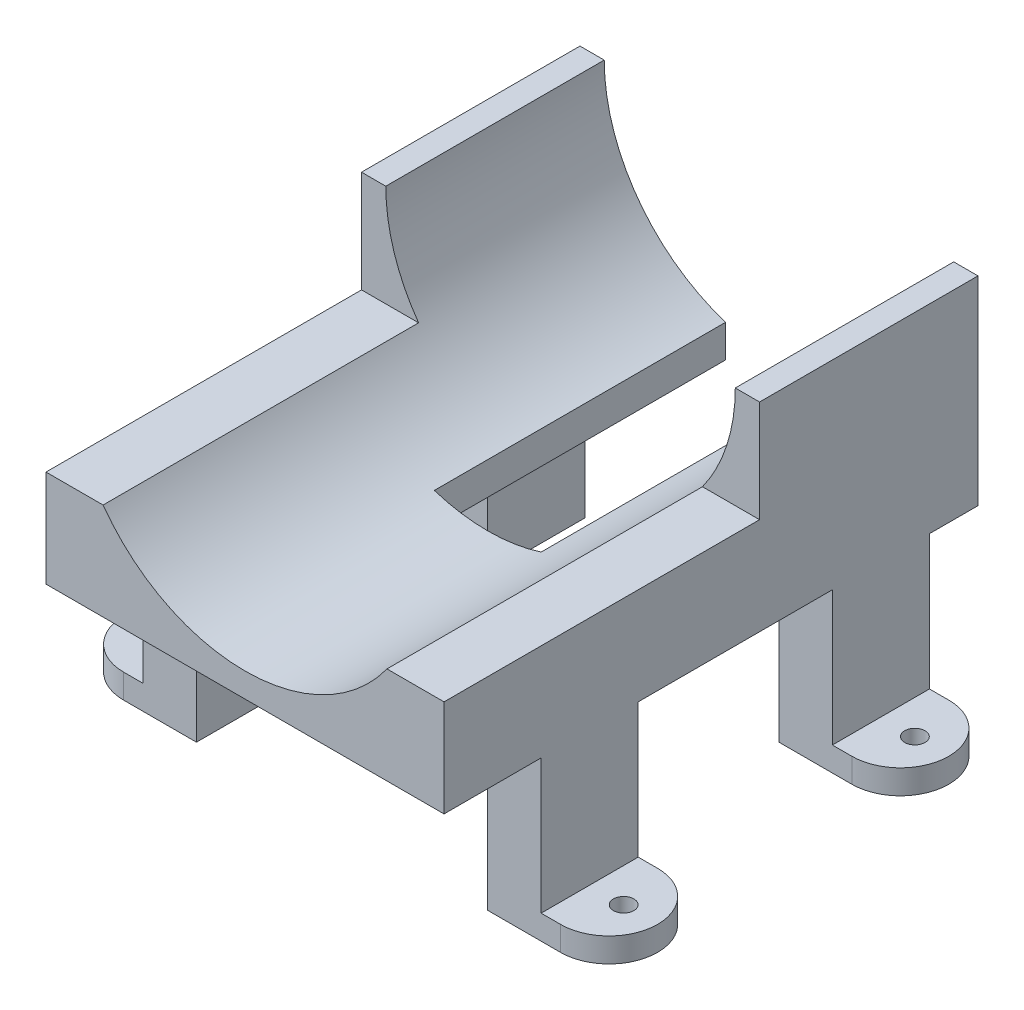
from build123d import *

# Parameters (mm, degrees)
SKETCH_1_R               = 36
EXTRUDE_1_DEPTH          = 90
SKETCH_2_W               = 22
SKETCH_2_H               = 6.721726998
CUT_EXTRUDE_1_DEPTH      = 60
CUT_EXTRUDE_2_DEPTH      = 108.060730429
CUT_EXTRUDE_2_DEPTH_BACK = 108.060730429
EXTRUDE_3_DEPTH          = 20
SKETCH_5_R               = 2.1
CUT_EXTRUDE_3_DEPTH      = 126.87569265
PATTERN_LINEAR_1_COUNT   = 2
PATTERN_LINEAR_1_PITCH   = 60
EXTRUDE_4_DEPTH          = 20


with BuildPart() as part:
    # 草圖1 → 填料-伸長1 (new body)
    with BuildSketch(Plane.XY):
        with BuildLine():
            Line((-41, 0), (-41, -41))
            Line((-41, -41), (41, -41))
            Line((41, -41), (41, 0))
            ThreePointArc((41, 0), (0, 41), (-41, 0))
        make_face()
        with Locations(Location((0, 0, 0), (0, 0, 180))):
            Circle(SKETCH_1_R, mode=Mode.SUBTRACT)
    extrude(amount=EXTRUDE_1_DEPTH)

    # 草圖2 → 除料-伸長1 (cut)
    with BuildSketch(Plane.XY):
        with Locations((0, -37.639136501)):
            Rectangle(SKETCH_2_W, SKETCH_2_H)
    extrude(amount=CUT_EXTRUDE_1_DEPTH, mode=Mode.SUBTRACT)

    # 草圖3 → 除料-伸長2 (cut, two sides: drawn at the far end of the back side and taken through both)
    with BuildSketch(Plane(origin=(0, 0, 0), x_dir=(0, 0, -1), z_dir=(1, 0, 0)).offset(-CUT_EXTRUDE_2_DEPTH_BACK)):
        Polygon((0, 41), (-90, 41), (-90, -21), (-45, -21), (-45, 0), (0, 0), align=None)
    extrude(amount=CUT_EXTRUDE_2_DEPTH + CUT_EXTRUDE_2_DEPTH_BACK, mode=Mode.SUBTRACT)

    # 草圖4 → 填料-伸長3 (add)
    with BuildSketch(Plane.XY.offset(90)):
        with BuildLine():
            Line((-30, -73.7), (-30, -27.946386022))
            ThreePointArc((-30, -27.946386022), (-32.791276328, -24.611637258), (-35.213640705, -21))
            Line((-35.213640705, -21), (-41, -21))
            Line((-41, -21), (-41, -68.7))
            Line((-41, -68.7), (-55, -68.7))
            Line((-55, -68.7), (-55, -73.7))
            Line((-55, -73.7), (-30, -73.7))
        make_face()
        with BuildLine():
            Line((30, -73.7), (30, -27.946386022))
            ThreePointArc((30, -27.946386022), (32.791276328, -24.611637258), (35.213640705, -21))
            Line((35.213640705, -21), (41, -21))
            Line((41, -21), (41, -68.7))
            Line((41, -68.7), (55, -68.7))
            Line((55, -68.7), (55, -73.7))
            Line((55, -73.7), (30, -73.7))
        make_face()
    extrude_3 = extrude(amount=-EXTRUDE_3_DEPTH)

    # 草圖5 → 除料-伸長3 (cut, through all)
    with BuildSketch(Plane(origin=(0, -68.7, 0), x_dir=(1, 0, 0), z_dir=(0, 1, 0))):
        with Locations(Location((-48, -80, 0), (0, 0, 180))):
            Circle(SKETCH_5_R)
        with Locations(Location((48, -80, 0), (0, 0, 180))):
            Circle(SKETCH_5_R)
        with BuildLine():
            Line((45, -70), (45, -66.851466146))
            Line((45, -66.851466146), (57.675759509, -66.851466146))
            Line((57.675759509, -66.851466146), (57.675759509, -92.046945096))
            Line((57.675759509, -92.046945096), (45, -92.046945096))
            Line((45, -92.046945096), (45, -90))
            ThreePointArc((45, -90), (55, -80), (45, -70))
        make_face()
        with BuildLine():
            Line((-57.675759509, -92.046945096), (-45, -92.046945096))
            Line((-45, -92.046945096), (-45, -90))
            ThreePointArc((-45, -90), (-55, -80), (-45, -70))
            Line((-45, -70), (-45, -66.851466146))
            Line((-45, -66.851466146), (-57.675759509, -66.851466146))
            Line((-57.675759509, -66.851466146), (-57.675759509, -92.046945096))
        make_face()
    cut_extrude_3 = extrude(amount=-CUT_EXTRUDE_3_DEPTH, mode=Mode.SUBTRACT)

    # 直線複製排列1: 填料-伸長3, 除料-伸長3 ×2
    with Locations(*[(0, 0, -i * PATTERN_LINEAR_1_PITCH) for i in range(1, PATTERN_LINEAR_1_COUNT)]):
        add(extrude_3)
        add(cut_extrude_3, mode=Mode.SUBTRACT)

    # 草圖6 → 填料-伸長4 (add)
    with BuildSketch(Plane.XY.offset(90)):
        with BuildLine():
            Line((-29.240383034, -21), (-41.000001526, -21))
            Line((-41.000001526, -21), (-41, -41))
            Line((-41, -41), (41, -41))
            Line((41, -41), (41, -21))
            Line((41, -21), (29.240383034, -21))
            ThreePointArc((29.240383034, -21), (0, -36), (-29.240383034, -21))
        make_face()
    extrude(amount=EXTRUDE_4_DEPTH)


solid = part.part
